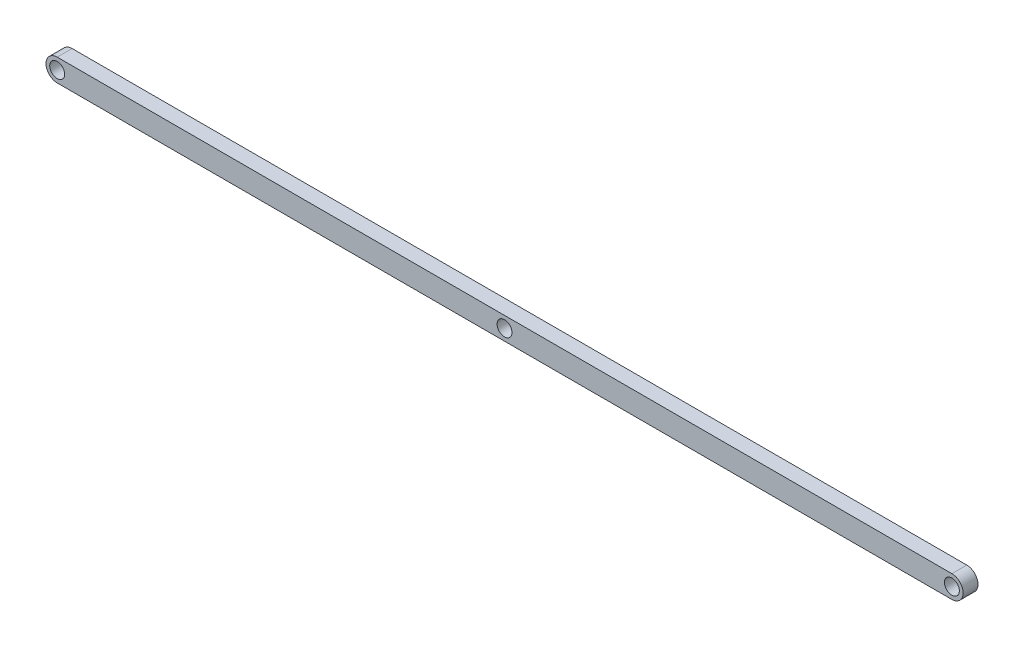
from build123d import *

# Parameters (mm, degrees)
SKETCH2_R           = 1.905
SKETCH2_R_2         = 1.27
BOSS_EXTRUDE1_DEPTH = 2.54


with BuildPart() as part:
    # Sketch2 → Boss-Extrude1 (new body)
    # profile 1 of 5: a face of its own
    with BuildSketch(Plane.XY):
        with BuildLine():
            Line((0, 1.905), (-76.2, 1.905))
            ThreePointArc((-76.2, 1.905), (-74.852961582, 1.347038418), (-74.295, 0))
            ThreePointArc((-74.295, 0), (-74.852961582, -1.347038418), (-76.2, -1.905))
            Line((-76.2, -1.905), (-1.9e-08, -1.905))
            ThreePointArc((-1.9e-08, -1.905), (-1.905, 9e-09), (0, 1.905))
        make_face()
    # profile 2 of 5: a face of its own
    with BuildSketch(Plane.XY):
        with Locations((-76.2, 0)):
            Circle(SKETCH2_R)
        with Locations((-76.2, 0)):
            Circle(SKETCH2_R_2, mode=Mode.SUBTRACT)
    # profile 3 of 5: a face of its own
    with BuildSketch(Plane.XY):
        with BuildLine():
            Line((76.2, 1.905), (0, 1.905))
            ThreePointArc((0, 1.905), (1.347038418, 1.347038418), (1.905, 0))
            ThreePointArc((1.905, 0), (1.347038412, -1.347038425), (-1.9e-08, -1.905))
            Line((-1.9e-08, -1.905), (76.2, -1.905))
            ThreePointArc((76.2, -1.905), (74.295, 0), (76.2, 1.905))
        make_face()
    # profile 4 of 5: a face of its own
    with BuildSketch(Plane.XY):
        with Locations((76.2, 0)):
            Circle(SKETCH2_R)
        with Locations((76.2, 0)):
            Circle(SKETCH2_R_2, mode=Mode.SUBTRACT)
    # profile 5 of 5: a face of its own
    with BuildSketch(Plane.XY):
        Circle(SKETCH2_R)
        Circle(SKETCH2_R_2, mode=Mode.SUBTRACT)
    extrude(amount=BOSS_EXTRUDE1_DEPTH)


solid = part.part
